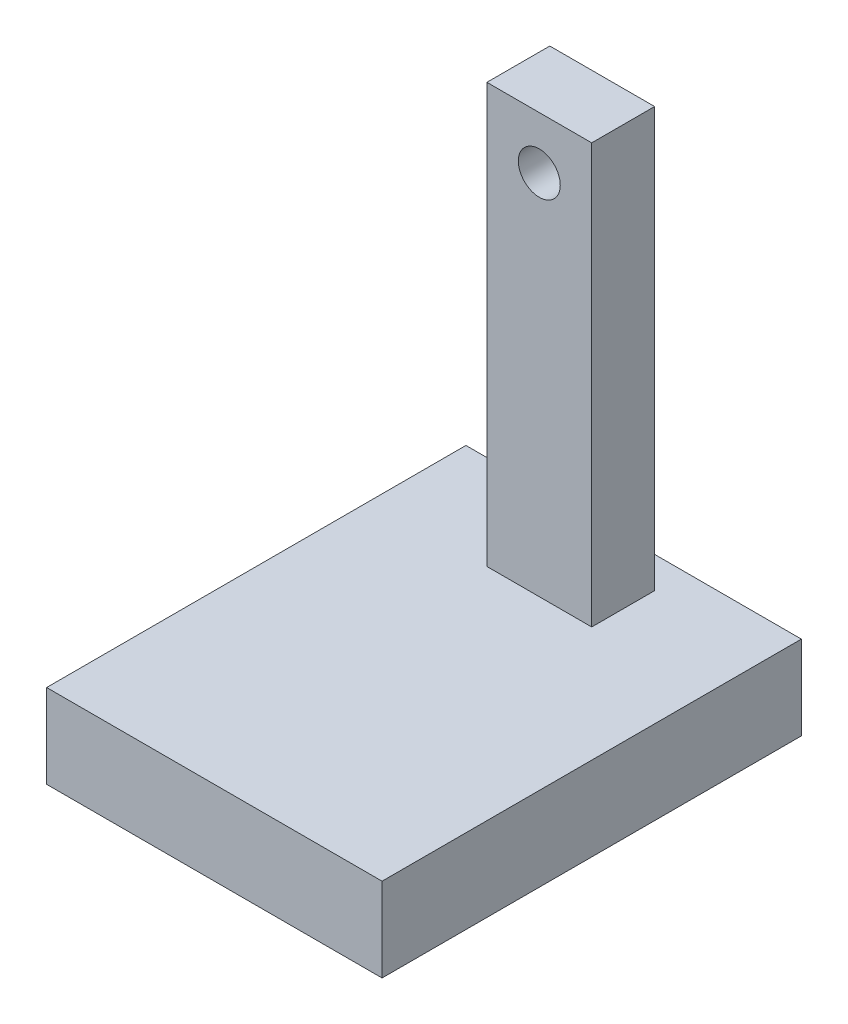
from build123d import *

# Parameters (mm, degrees)
SKETCH1_W           = 80
SKETCH1_H           = 100
BOSS_EXTRUDE2_DEPTH = 20
SKETCH2_W           = 25
SKETCH2_H           = 15
BOSS_EXTRUDE3_DEPTH = 100
CUT_EXTRUDE1_REACH  = 150.345
SKETCH3_R           = 5
SKETCH4_W           = 20
SKETCH4_H           = 20
BOSS_EXTRUDE4_DEPTH = 5


with BuildPart() as part:
    # Sketch1 → Boss-Extrude2 (new body)
    with BuildSketch(Plane(origin=(0, 0, 0), x_dir=(1, 0, 0), z_dir=(0, 1, 0))):
        Rectangle(SKETCH1_W, SKETCH1_H)
    extrude(amount=BOSS_EXTRUDE2_DEPTH)

    # Sketch2 → Boss-Extrude3 (add)
    with BuildSketch(Plane(origin=(0, 20, 0), x_dir=(1, 0, 0), z_dir=(0, 1, 0))):
        with Locations((0, 35)):
            Rectangle(SKETCH2_W, SKETCH2_H)
    extrude(amount=BOSS_EXTRUDE3_DEPTH)

    # Sketch3 → Cut-Extrude1 (cut, up to next)
    with BuildSketch(Plane.XY.offset(-27.5), mode=Mode.PRIVATE) as cut_extrude1_sk1:
        with Locations((0, 107.5)):
            Circle(SKETCH3_R)
    cut_extrude1_tool1 = extrude(cut_extrude1_sk1.sketch, amount=-CUT_EXTRUDE1_REACH, mode=Mode.PRIVATE) & part.part
    add(cut_extrude1_tool1.solids().sort_by_distance((0, 107.5, -27.5))[0], mode=Mode.SUBTRACT)

    # Sketch4 → Boss-Extrude4 (add)
    with BuildSketch(Plane.XZ):
        with Locations((-25, 35)):
            Rectangle(SKETCH4_W, SKETCH4_H)
        with Locations((25, 35)):
            Rectangle(SKETCH4_W, SKETCH4_H)
        with Locations((25, -35)):
            Rectangle(SKETCH4_W, SKETCH4_H)
        with Locations((-25, -35)):
            Rectangle(SKETCH4_W, SKETCH4_H)
    extrude(amount=BOSS_EXTRUDE4_DEPTH)


solid = part.part
